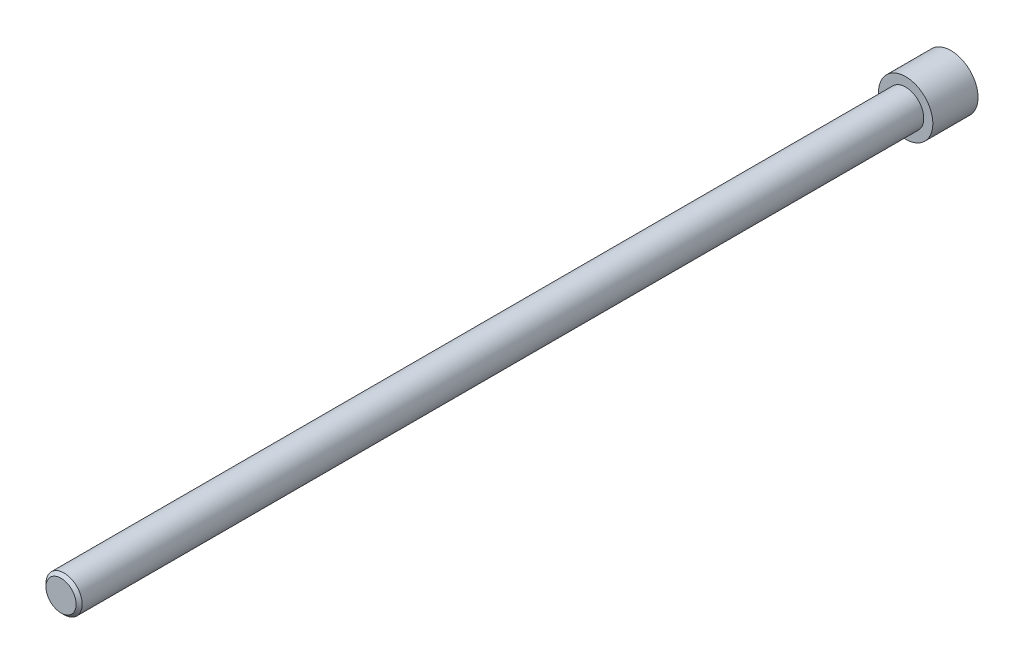
from build123d import *

# Parameters (mm, degrees)
SKICA1_R                 = 3
P_IDAT_VYSUNUT_M1_DEPTH  = 140
SKICA2_R                 = 4.5
P_IDAT_VYSUNUT_M2_DEPTH  = 7.5
ODEBRAT_VYSUNUT_M1_DEPTH = 4.5
ZKOSEN_1_SIZE            = 0.5


with BuildPart() as part:
    # Skica1 → Přidat vysunutím1 (new body)
    with BuildSketch(Plane.XY):
        Circle(SKICA1_R)
    extrude(amount=P_IDAT_VYSUNUT_M1_DEPTH)

    # Skica2 → Přidat vysunutím2 (add)
    with BuildSketch(Plane(origin=(0, 0, 0), x_dir=(-1, 0, 0), z_dir=(0, 0, -1))):
        Circle(SKICA2_R)
    extrude(amount=P_IDAT_VYSUNUT_M2_DEPTH)

    # Skica3 → Odebrat vysunutím1 (cut)
    with BuildSketch(Plane(origin=(0, 0, -7.5), x_dir=(-1, 0, 0), z_dir=(0, 0, -1))):
        Polygon((0, -2.771281292), (2.4, -1.385640646), (2.4, 1.385640646), (0, 2.771281292), (-2.4, 1.385640646), (-2.4, -1.385640646), align=None)
    extrude(amount=-ODEBRAT_VYSUNUT_M1_DEPTH, mode=Mode.SUBTRACT)

    # Zkosení1
    zkosen_1_edges = [part.edges().sort_by_distance(p)[0] for p in [
        (-3, 0, 140),
    ]]
    chamfer(zkosen_1_edges, length=ZKOSEN_1_SIZE)


solid = part.part
